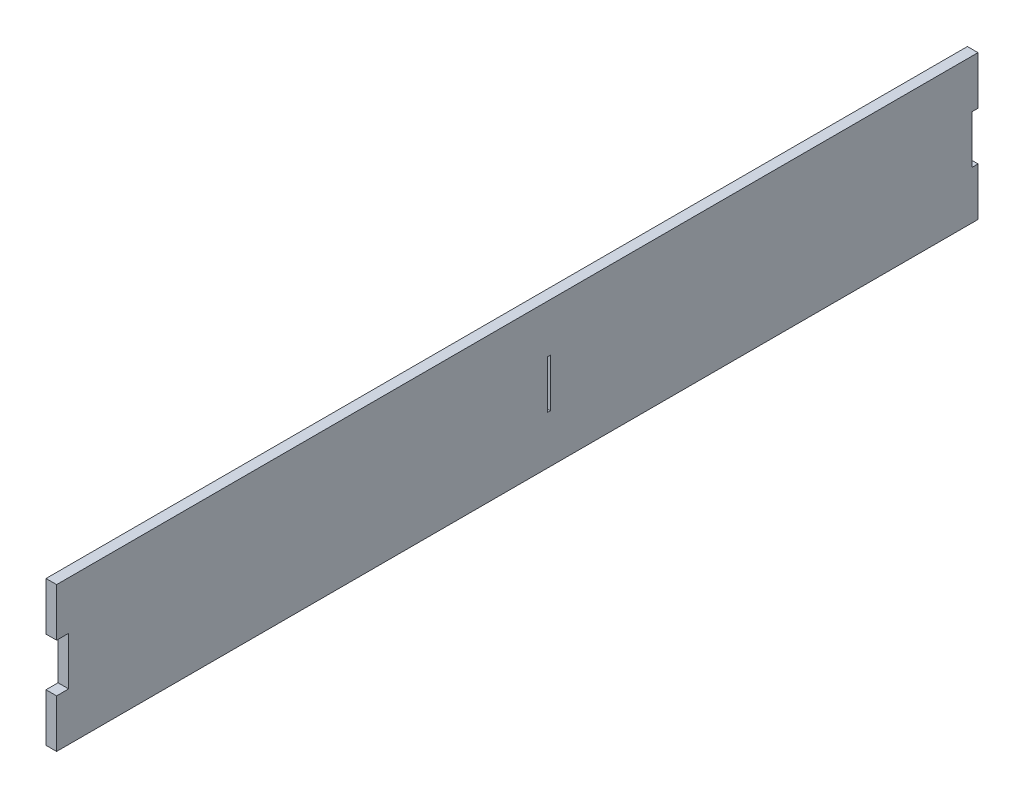
from build123d import *

# Parameters (mm, degrees)
SKETCH1_W           = 25.4
SKETCH1_H           = 1.5875
BOSS_EXTRUDE1_DEPTH = 5.588
SKETCH2_W           = 545.634359946
SKETCH2_H           = 68.698432751
CUT_EXTRUDE1_DEPTH  = 7.62


with BuildPart() as part:
    # Sketch1 → Boss-Extrude1 (new body)
    # profile 1 of 3: a face of its own
    with BuildSketch(Plane(origin=(-94.488, 0, 0), x_dir=(0, -1, 0), z_dir=(-1, 0, 0))):
        Polygon((136.525, -196.85), (111.125, -196.85), (111.125, -203.2), (85.725, -203.2), (85.725, -196.85), (60.325, -196.85), (60.325, -682.625), (85.725, -682.625), (85.725, -679.45), (111.125, -679.45), (111.125, -682.625), (136.525, -682.625), align=None)
        with Locations((98.425, -456.40625)):
            Rectangle(SKETCH1_W, SKETCH1_H, mode=Mode.SUBTRACT)
    # profile 2 of 3: a face of its own
    with BuildSketch(Plane(origin=(-94.488, 0, 0), x_dir=(0, -1, 0), z_dir=(-1, 0, 0))):
        with BuildLine():
            Line((149.225, -203.2), (136.525, -203.2))
            Line((136.525, -203.2), (136.525, -290.406498707))
            ThreePointArc((136.525, -290.406498707), (137.30121982, -286.034603668), (139.534994681, -282.197126202))
            Line((139.534994681, -282.197126202), (184.118202659, -229.57294303))
            ThreePointArc((184.118202659, -229.57294303), (185.23509009, -227.654204297), (185.6232, -225.468256778))
            Line((185.6232, -225.468256778), (185.6232, -203.2))
            Line((185.6232, -203.2), (168.275, -203.2))
            Line((168.275, -203.2), (168.275, -196.85))
            Line((168.275, -196.85), (149.225, -196.85))
            Line((149.225, -196.85), (149.225, -203.2))
        make_face()
    # profile 3 of 3: a face of its own
    with BuildSketch(Plane(origin=(-94.488, 0, 0), x_dir=(0, -1, 0), z_dir=(-1, 0, 0))):
        with BuildLine():
            ThreePointArc((138.226477372, -606.197045256), (136.957742006, -603.134047129), (136.525, -599.847045256))
            Line((136.525, -599.847045256), (136.525, -679.45))
            Line((136.525, -679.45), (146.05, -679.45))
            Line((146.05, -679.45), (146.05, -684.2125))
            Line((146.05, -684.2125), (161.925, -684.2125))
            Line((161.925, -684.2125), (161.925, -679.45))
            Line((161.925, -679.45), (171.45, -679.45))
            Line((171.45, -679.45), (171.45, -665.443351826))
            ThreePointArc((171.45, -665.443351826), (171.233628997, -663.79985089), (170.599261314, -662.268351826))
            Line((170.599261314, -662.268351826), (138.226477372, -606.197045256))
        make_face()
    extrude(amount=-BOSS_EXTRUDE1_DEPTH)

    # Sketch2 → Cut-Extrude1 (cut)
    with BuildSketch(Plane(origin=(-88.9, 0, 0), x_dir=(0, 0, -1), z_dir=(1, 0, 0))):
        with Locations((441.133658402, -170.874216375)):
            Rectangle(SKETCH2_W, SKETCH2_H)
    extrude(amount=-CUT_EXTRUDE1_DEPTH, mode=Mode.SUBTRACT)


solid = part.part
